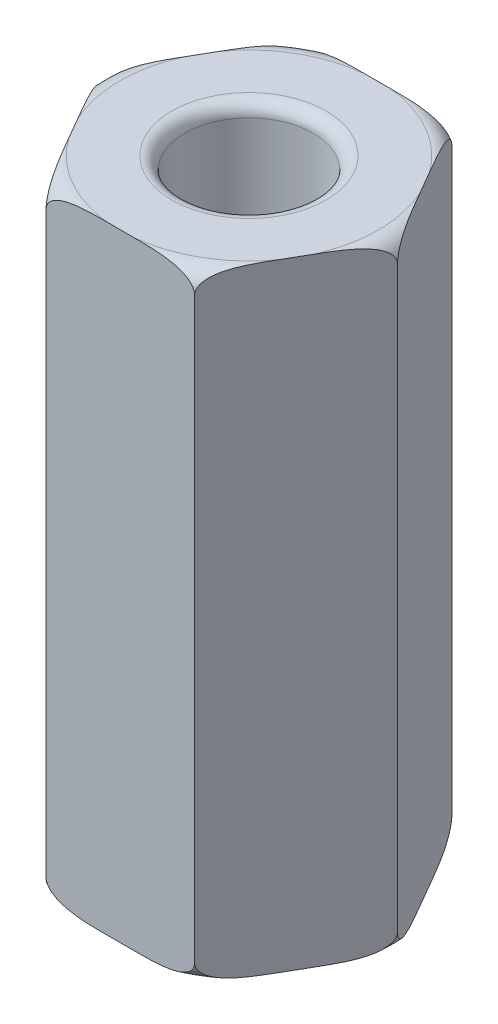
from build123d import *

# Parameters (mm, degrees)
BOSS_EXTRUDE1_DEPTH = 6
SKETCH2_R           = 1.25
CUT_EXTRUDE1_DEPTH  = 12
FILLET1_R           = 0.25


with BuildPart() as part:
    # Sketch1 → Boss-Extrude1 (new, symmetric)
    with BuildSketch(Plane(origin=(0, 0, 0), x_dir=(1, 0, 0), z_dir=(0, 1, 0))):
        Polygon((-2.886751346, 0), (-1.443375673, -2.5), (1.443375673, -2.5), (2.886751346, 0), (1.443375673, 2.5), (-1.443375673, 2.5), align=None)
    extrude(amount=BOSS_EXTRUDE1_DEPTH, both=True)

    # Sketch2 → Cut-Extrude1 (cut)
    with BuildSketch(Plane(origin=(0, 6, 0), x_dir=(1, 0, 0), z_dir=(0, 1, 0))):
        with Locations(Location((0, 0, 0), (0, 0, 270))):
            Circle(SKETCH2_R)
    extrude(amount=-CUT_EXTRUDE1_DEPTH, mode=Mode.SUBTRACT)

    # Sketch3 → Cut-Revolve1 (revolve, cut)
    with BuildSketch(Plane.XY):
        with BuildLine():
            Line((2.511751346, 6), (2.886751346, 6))
            Line((2.886751346, 6), (2.886751346, 5.625))
            ThreePointArc((2.886751346, 5.625), (2.776916389, 5.890165043), (2.511751346, 6))
        make_face()
        with BuildLine():
            Line((2.886751346, -6), (2.886751346, -5.625))
            ThreePointArc((2.886751346, -5.625), (2.776916389, -5.890165043), (2.511751346, -6))
            Line((2.511751346, -6), (2.886751346, -6))
        make_face()
    revolve(axis=Axis((0, 5.721589011, 0), (0, -1, 0)), mode=Mode.SUBTRACT)

    # Fillet1
    fillet1_edges = [part.edges().sort_by_distance(p)[0] for p in [
        (0, 6, -1.25),
        (0, -6, -1.25),
    ]]
    fillet(fillet1_edges, radius=FILLET1_R)


solid = part.part
